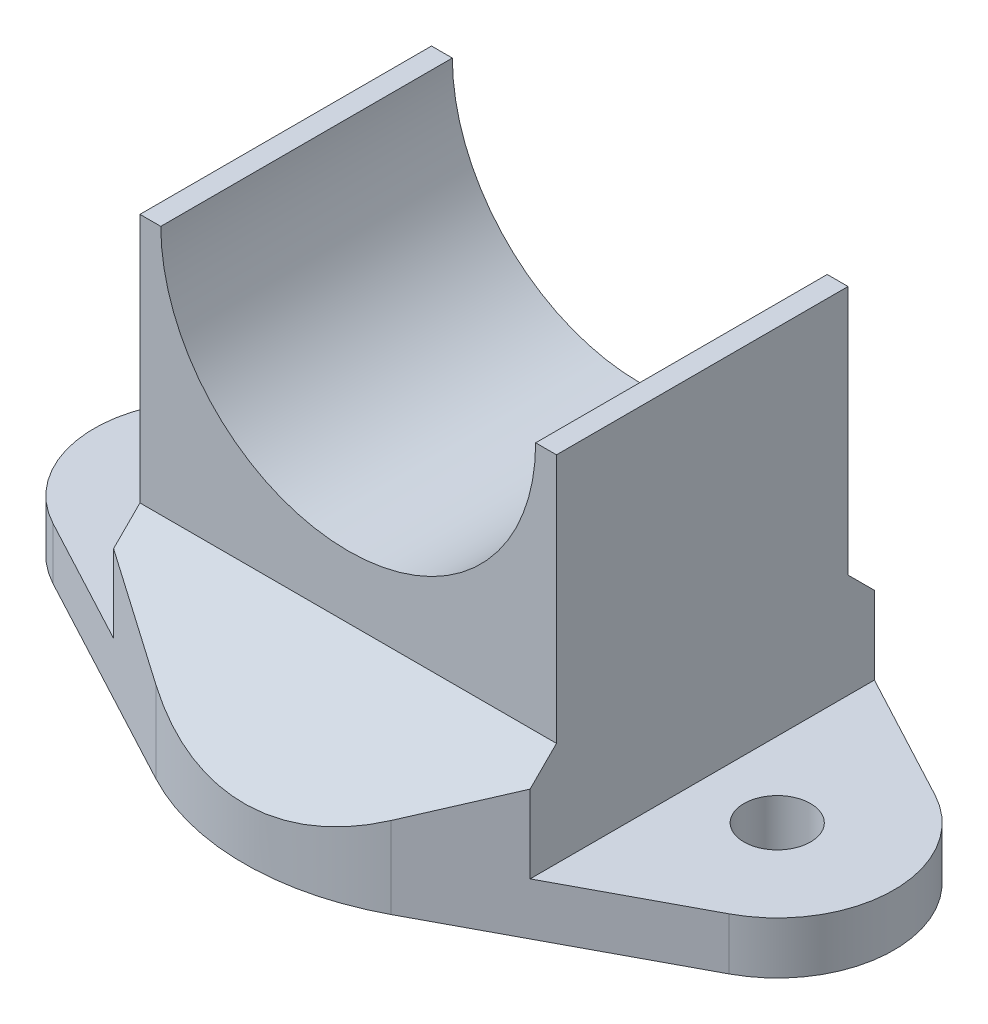
from build123d import *

# Parameters (mm, degrees)
SKETCH_1_R               = 1.6
EXTRUDE_1_DEPTH          = 2.5
EXTRUDE_2_DEPTH          = 10
EXTRUDE_2_DEPTH_BACK     = 10
CUT_EXTRUDE_START        = 12
SKETCH_4_R               = 25
CUT_EXTRUDE_3_DEPTH      = 12
CUT_EXTRUDE_4_DEPTH      = 12
CUT_EXTRUDE_4_DEPTH_BACK = 12
SKETCH_5_R               = 9


with BuildPart() as part:
    # 草图1 → 凸台-拉伸1 (new body)
    with BuildSketch(Plane(origin=(0, 0, 0), x_dir=(1, 0, 0), z_dir=(0, 1, 0))):
        with BuildLine():
            Line((16.235294118, -4.941176471), (5.647058824, -10.588235294))
            ThreePointArc((5.647058824, -10.588235294), (0, -12), (-5.647058824, -10.588235294))
            Line((-5.647058824, -10.588235294), (-16.235294118, -4.941176471))
            ThreePointArc((-16.235294118, -4.941176471), (-19.2, 0), (-16.235294118, 4.941176471))
            Line((-16.235294118, 4.941176471), (-5.647058824, 10.588235294))
            ThreePointArc((-5.647058824, 10.588235294), (0, 12), (5.647058824, 10.588235294))
            Line((5.647058824, 10.588235294), (16.235294118, 4.941176471))
            ThreePointArc((16.235294118, 4.941176471), (19.2, 0), (16.235294118, -4.941176471))
        make_face()
        with Locations((-13.6, 0)):
            Circle(SKETCH_1_R, mode=Mode.SUBTRACT)
        with Locations((13.6, 0)):
            Circle(SKETCH_1_R, mode=Mode.SUBTRACT)
    extrude(amount=-EXTRUDE_1_DEPTH)

    # 草图2 → 凸台-拉伸2 (add, two sides: drawn at the far end of the back side and taken through both)
    with BuildSketch(Plane(origin=(0, 0, 0), x_dir=(0, 0, -1), z_dir=(1, 0, 0)).offset(-EXTRUDE_2_DEPTH_BACK)):
        Polygon((12, 0), (-12, 0), (-7, 5), (-7, 17), (7, 17), (7, 5), align=None)
    extrude(amount=EXTRUDE_2_DEPTH + EXTRUDE_2_DEPTH_BACK)

    # 草图4 → 切除-拉伸3 (cut)
    with BuildSketch(Plane(origin=(0, 0, 0), x_dir=(1, 0, 0), z_dir=(0, 1, 0)).offset(CUT_EXTRUDE_START)):
        Circle(SKETCH_4_R)
        with BuildLine():
            Line((5.647058824, -10.588235294), (10, -8.266666667))
            Line((10, -8.266666667), (16.235294118, -4.941176471))
            ThreePointArc((16.235294118, -4.941176471), (19.2, 0), (16.235294118, 4.941176471))
            Line((16.235294118, 4.941176471), (10, 8.266666667))
            Line((10, 8.266666667), (5.647058824, 10.588235294))
            ThreePointArc((5.647058824, 10.588235294), (2.9104275, 11.641710002), (0, 12))
            ThreePointArc((0, 12), (-2.9104275, 11.641710002), (-5.647058824, 10.588235294))
            Line((-5.647058824, 10.588235294), (-10, 8.266666667))
            Line((-10, 8.266666667), (-16.235294118, 4.941176471))
            ThreePointArc((-16.235294118, 4.941176471), (-19.2, 0), (-16.235294118, -4.941176471))
            Line((-16.235294118, -4.941176471), (-10, -8.266666667))
            Line((-10, -8.266666667), (-5.647058824, -10.588235294))
            ThreePointArc((-5.647058824, -10.588235294), (-2.9104275, -11.641710002), (0, -12))
            ThreePointArc((0, -12), (2.9104275, -11.641710002), (5.647058824, -10.588235294))
        make_face(mode=Mode.SUBTRACT)
    extrude(amount=-CUT_EXTRUDE_3_DEPTH, mode=Mode.SUBTRACT)

    # 草图5 → 切除-拉伸4 (cut, two sides: drawn at the far end of the back side and taken through both)
    with BuildSketch(Plane.XY.offset(-CUT_EXTRUDE_4_DEPTH_BACK)):
        with Locations((0, 17)):
            Circle(SKETCH_5_R)
    extrude(amount=CUT_EXTRUDE_4_DEPTH + CUT_EXTRUDE_4_DEPTH_BACK, mode=Mode.SUBTRACT)


solid = part.part
